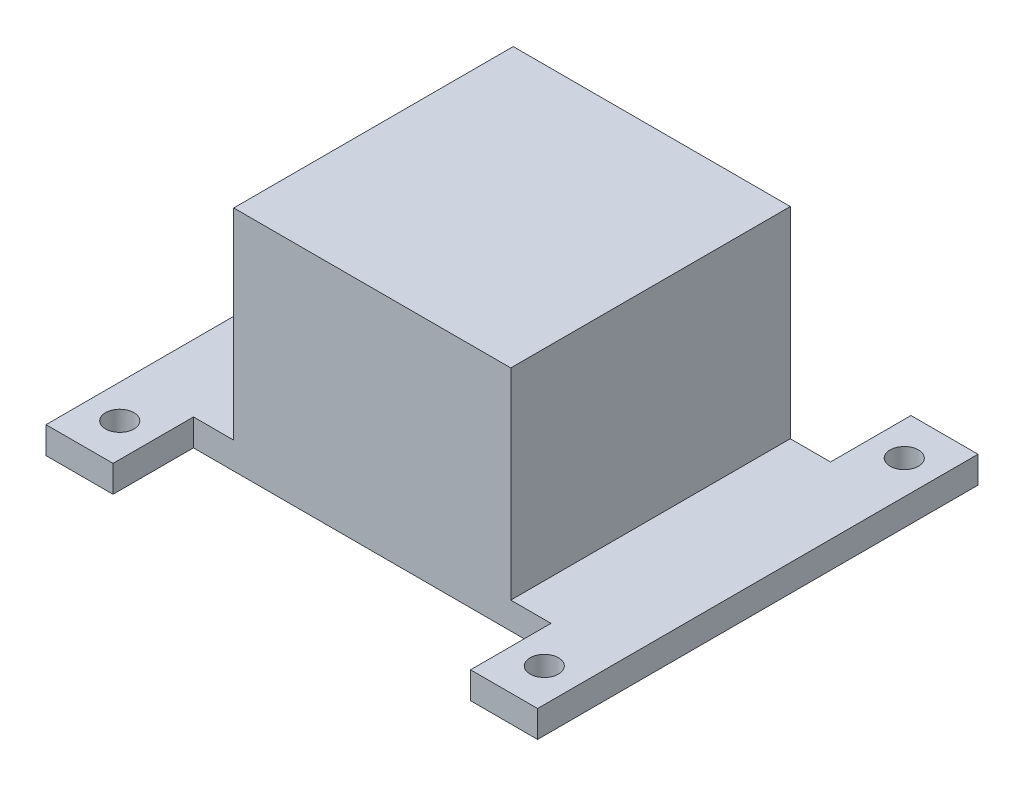
from build123d import *

# Parameters (mm, degrees)
SKETCH1_W           = 110
SKETCH1_H           = 62.55
BOSS_EXTRUDE1_DEPTH = 6
CUT_EXTRUDE1_REACH  = 65.554
SKETCH2_R           = 9.5
SKETCH4_W           = 15
SKETCH4_H           = 6
BOSS_EXTRUDE2_DEPTH = 18
SKETCH5_R           = 3.175
CUT_EXTRUDE3_DEPTH  = 18
SKETCH6_W           = 5
SKETCH6_H           = 62.55
BOSS_EXTRUDE3_DEPTH = 40
SKETCH7_W           = 62.55
SKETCH7_H           = 5
BOSS_EXTRUDE4_DEPTH = 62
BOSS_EXTRUDE5_REACH = 88.476
SKETCH8_W           = 52
SKETCH8_H           = 5


with BuildPart() as part:
    # Sketch1 → Boss-Extrude1 (new body)
    with BuildSketch(Plane(origin=(0, 0, 0), x_dir=(1, 0, 0), z_dir=(0, 1, 0))):
        Rectangle(SKETCH1_W, SKETCH1_H)
    extrude(amount=BOSS_EXTRUDE1_DEPTH)

    # Sketch2 → Cut-Extrude1 (cut, up to next)
    with BuildSketch(Plane(origin=(0, 6, 0), x_dir=(1, 0, 0), z_dir=(0, 1, 0)), mode=Mode.PRIVATE) as cut_extrude1_sk1:
        with Locations(Location((0, 2.725, 0), (0, 0, 270))):
            Circle(SKETCH2_R)
    cut_extrude1_tool1 = extrude(cut_extrude1_sk1.sketch, amount=-CUT_EXTRUDE1_REACH, mode=Mode.PRIVATE) & part.part
    add(cut_extrude1_tool1.solids().sort_by_distance((0, 6, -2.725))[0], mode=Mode.SUBTRACT)

    # Sketch4 → Boss-Extrude2 (add)
    with BuildSketch(Plane.XY.offset(31.275)):
        with Locations((-47.5, 3)):
            Rectangle(SKETCH4_W, SKETCH4_H)
        with Locations((47.5, 3)):
            Rectangle(SKETCH4_W, SKETCH4_H)
    boss_extrude2 = extrude(amount=BOSS_EXTRUDE2_DEPTH)

    # Sketch5 → Cut-Extrude3 (cut)
    with BuildSketch(Plane(origin=(0, 6, 0), x_dir=(1, 0, 0), z_dir=(0, 1, 0))):
        with Locations(Location((-47.5, -40.275, 0), (0, 0, 270))):
            Circle(SKETCH5_R)
        with Locations(Location((47.5, -40.275, 0), (0, 0, 90))):
            Circle(SKETCH5_R)
    cut_extrude3 = extrude(amount=-CUT_EXTRUDE3_DEPTH, mode=Mode.SUBTRACT)

    # Mirror1: Boss-Extrude2, Cut-Extrude3 across plane
    add(boss_extrude2.mirror(Plane.XY))
    add(cut_extrude3.mirror(Plane.XY), mode=Mode.SUBTRACT)

    # Sketch6 → Boss-Extrude3 (add)
    with BuildSketch(Plane(origin=(0, 6, 0), x_dir=(1, 0, 0), z_dir=(0, 1, 0))):
        with Locations((28.5, 0)):
            Rectangle(SKETCH6_W, SKETCH6_H)
        with Locations((-28.5, 0)):
            Rectangle(SKETCH6_W, SKETCH6_H)
    extrude(amount=BOSS_EXTRUDE3_DEPTH)

    # Sketch7 → Boss-Extrude4 (add)
    with BuildSketch(Plane(origin=(31, 0, 0), x_dir=(0, 0, -1), z_dir=(1, 0, 0))):
        with Locations((0, 48.5)):
            Rectangle(SKETCH7_W, SKETCH7_H)
    extrude(amount=-BOSS_EXTRUDE4_DEPTH)

    # Sketch8 → Boss-Extrude5 (add, up to next)
    with BuildSketch(Plane(origin=(0, 6, 0), x_dir=(1, 0, 0), z_dir=(0, 1, 0)), mode=Mode.PRIVATE) as boss_extrude5_sk1:
        with Locations((0, -28.775)):
            Rectangle(SKETCH8_W, SKETCH8_H)
    boss_extrude5_tool1 = extrude(boss_extrude5_sk1.sketch, amount=BOSS_EXTRUDE5_REACH, mode=Mode.PRIVATE) - part.part
    add(boss_extrude5_tool1.solids().sort_by_distance((0, 6, 28.775))[0])


solid = part.part
